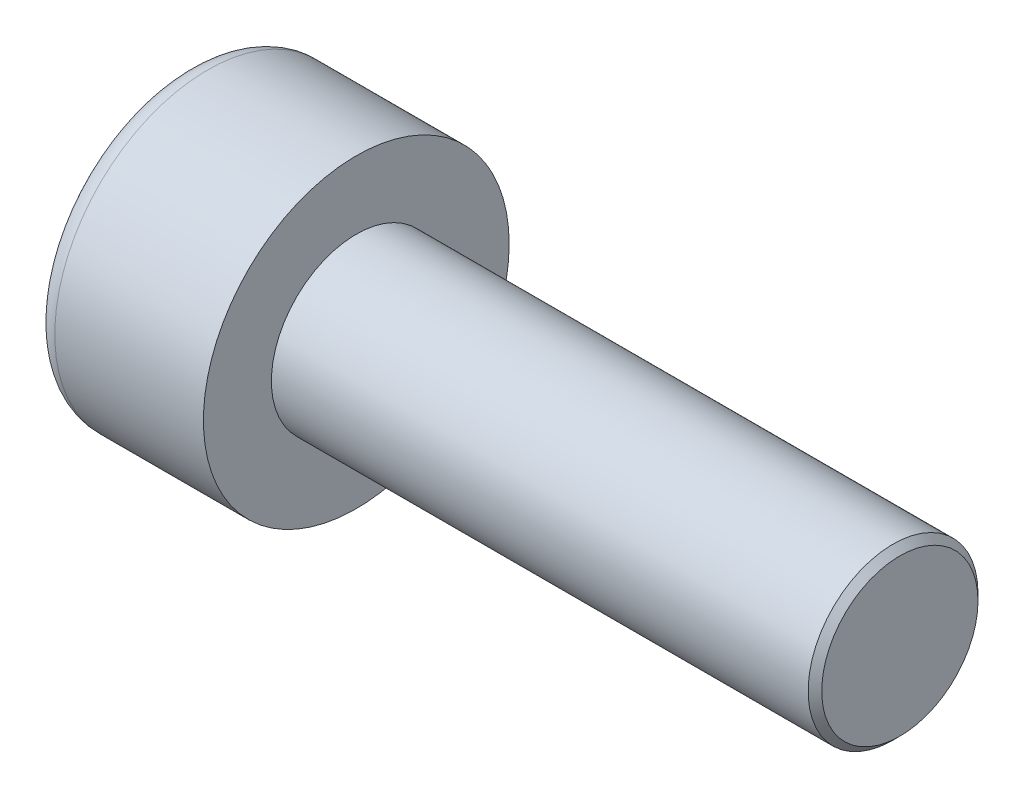
from build123d import *

# Parameters (mm, degrees)
SKETCH1_R           = 2.25
BASEHEAD_DEPTH      = 2.5
SKETCH2_R           = 1.25
BASEBODY_DEPTH      = 8
HEXAGONSOCKET_DEPTH = 1.1
TOPFILLET_R         = 0.3125
CHAMFER1_SIZE       = 0.1


with BuildPart() as part:
    # Sketch1 → BaseHead (new body)
    with BuildSketch(Plane(origin=(0, 0, 0), x_dir=(0, 0, -1), z_dir=(1, 0, 0))):
        Circle(SKETCH1_R)
    extrude(amount=BASEHEAD_DEPTH)

    # Sketch2 → BaseBody (add)
    with BuildSketch(Plane(origin=(2.5, 0, 0), x_dir=(0, 0, -1), z_dir=(1, 0, 0))):
        Circle(SKETCH2_R)
    extrude(amount=BASEBODY_DEPTH)

    # Sketch3 → HexagonSocket (cut)
    with BuildSketch(Plane(origin=(0, 0, 0), x_dir=(0, 0, -1), z_dir=(1, 0, 0))):
        Polygon((1.154700538, 0), (0.577350269, 1), (-0.577350269, 1), (-1.154700538, 0), (-0.577350269, -1), (0.577350269, -1), align=None)
    extrude(amount=HEXAGONSOCKET_DEPTH, mode=Mode.SUBTRACT)

    # Sketch4 → Cut-Revolve1 (revolve, cut)
    with BuildSketch(Plane(origin=(-4.19613823, 0.75, 0), x_dir=(-1, 0, 0), z_dir=(0, 0, 1)), mode=Mode.PRIVATE) as cut_revolve1_sk:
        Polygon((-5.29613823, 1.75), (-5.873488499, 0.75), (-5.29613823, 0.75), align=None)
    revolve(cut_revolve1_sk.sketch.rotate(Axis((0.838992387, 0, 0), (-1, 0, 0)), 90), axis=Axis((0.838992387, 0, 0), (-1, 0, 0)), mode=Mode.SUBTRACT)

    # TopFillet
    topfillet_edges = [part.edges().sort_by_distance(p)[0] for p in [
        (0, 0, 2.25),
    ]]
    fillet(topfillet_edges, radius=TOPFILLET_R)

    # Chamfer1
    chamfer1_edges = [part.edges().sort_by_distance(p)[0] for p in [
        (10.5, 0, 1.25),
    ]]
    chamfer(chamfer1_edges, length=CHAMFER1_SIZE)


solid = part.part
